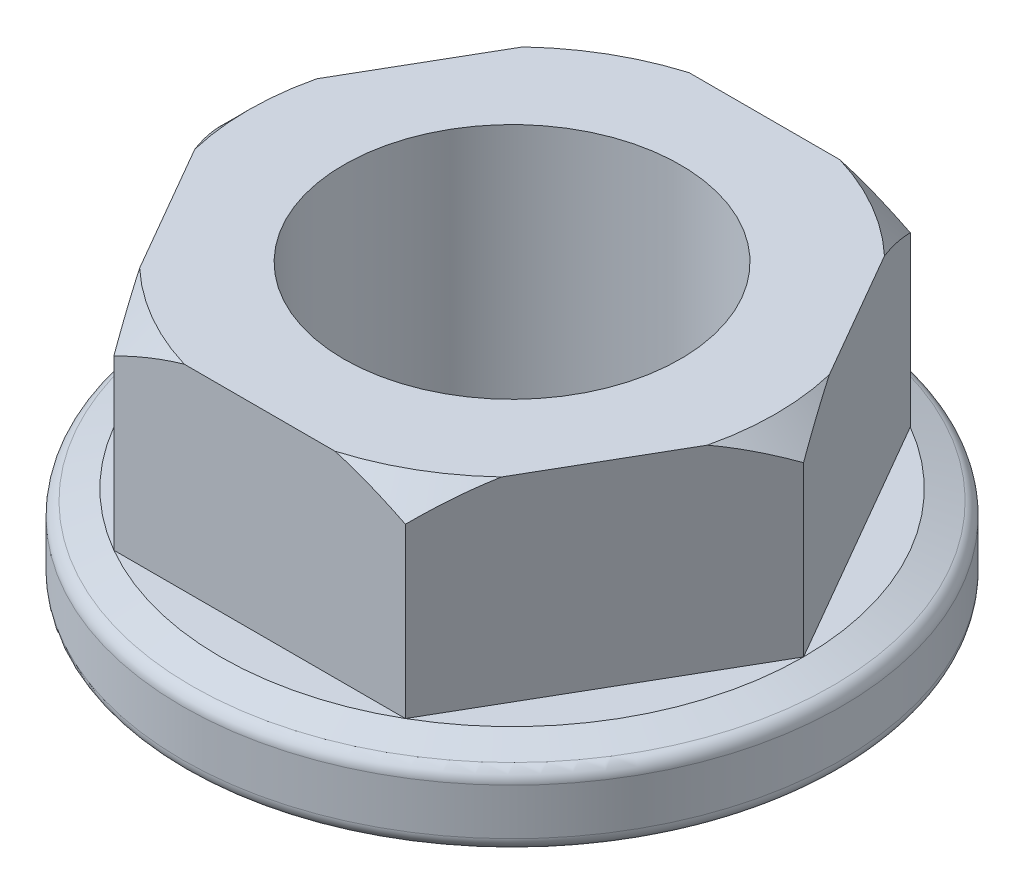
from build123d import *

# Parameters (mm, degrees)
SKETCH1_R           = 6
BOSS_EXTRUDE1_DEPTH = 10
SKETCH2_R           = 11.75
BOSS_EXTRUDE2_DEPTH = 3
FILLET1_R           = 0.5


with BuildPart() as part:
    # Sketch1 → Boss-Extrude1 (new body)
    with BuildSketch(Plane(origin=(0, 0, 0), x_dir=(1, 0, 0), z_dir=(0, 1, 0))):
        Polygon((10.392304845, 0), (5.196152423, 9), (-5.196152423, 9), (-10.392304845, 0), (-5.196152423, -9), (5.196152423, -9), align=None)
        with Locations(Location((0, 0, 0), (0, 0, 270))):
            Circle(SKETCH1_R, mode=Mode.SUBTRACT)
    extrude(amount=BOSS_EXTRUDE1_DEPTH)

    # Sketch2 → Boss-Extrude2 (add)
    with BuildSketch(Plane.XZ):
        with Locations(Location((0, 0, 0), (0, 0, 270))):
            Circle(SKETCH2_R)
        Polygon((10.392304845, 0), (5.196152423, 9), (-5.196152423, 9), (-10.392304845, 0), (-5.196152423, -9), (5.196152423, -9), align=None, mode=Mode.SUBTRACT)
    extrude(amount=-BOSS_EXTRUDE2_DEPTH)

    # Sketch3 → Cut-Revolve1 (revolve, cut)
    with BuildSketch(Plane.XY, mode=Mode.PRIVATE) as cut_revolve1_sk:
        Polygon((-10.392304845, 9), (-9.392304845, 10), (-10.392304845, 10), align=None)
        Polygon((-10.392304845, 3), (-11.75, 2.5), (-11.75, 3), align=None)
    revolve(cut_revolve1_sk.sketch.rotate(Axis((0, 0, 0), (0, 1, 0)), 270), axis=Axis((0, 0, 0), (0, 1, 0)), mode=Mode.SUBTRACT)

    # Fillet1
    fillet1_edges = [part.edges().sort_by_distance(p)[0] for p in [
        (0, 0, 11.75),
        (0, 2.5, 11.75),
    ]]
    fillet(fillet1_edges, radius=FILLET1_R)


solid = part.part
